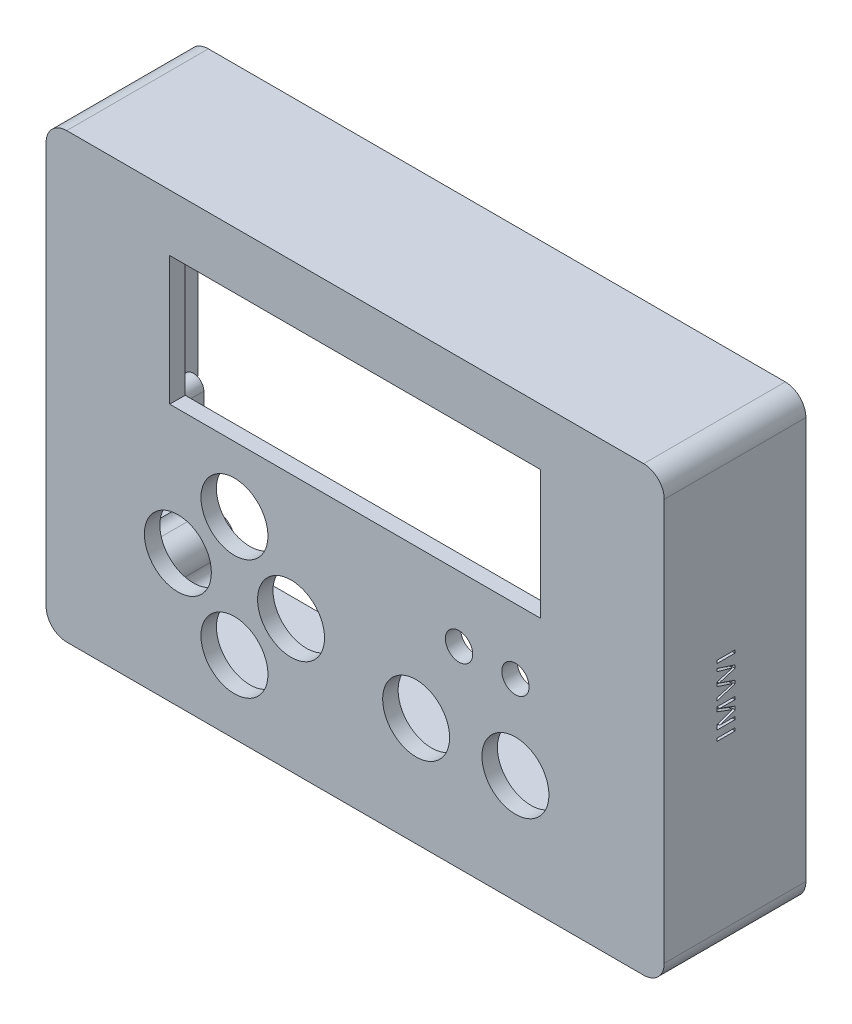
from build123d import *
from build123d.topology import SkipClean

# Parameters (mm, degrees)
SKETCH2_R           = 6.5
SKETCH2_R_2         = 2.65
SKETCH2_W           = 72
SKETCH2_H           = 25
BOSS_EXTRUDE1_DEPTH = 2.5
BOSS_EXTRUDE2_START = 25
BOSS_EXTRUDE2_DEPTH = 25
BOSS_EXTRUDE3_START = 0.5
SKETCH5_R           = 3.75
SKETCH5_R_2         = 2.65
SKETCH5_R_3         = 7.5
SKETCH5_R_4         = 6.5
SKETCH5_W           = 74
SKETCH5_H           = 27
SKETCH5_W_2         = 72
SKETCH5_H_2         = 25
BOSS_EXTRUDE3_DEPTH = 0.5
BOSS_EXTRUDE4_DEPTH = 4
BOSS_EXTRUDE6_START = 25
SKETCH7_R           = 1.7
BOSS_EXTRUDE6_DEPTH = 25
FILLET2_R           = 2
CUT_EXTRUDE1_REACH  = 131.9
SKETCH8_W           = 10
SKETCH8_H           = 20
SKETCH9_W           = 3.5
SKETCH9_H           = 0.538461538
CUT_EXTRUDE2_DEPTH  = 0.75


with BuildPart() as part:
    # Sketch2 → Boss-Extrude1 (new body)
    with BuildSketch(Plane.XY):
        with BuildLine():
            Line((-56, -43), (56, -43))
            ThreePointArc((56, -43), (58.828427125, -41.828427125), (60, -39))
            Line((60, -39), (60, 39))
            ThreePointArc((60, 39), (58.828427125, 41.828427125), (56, 43))
            Line((56, 43), (-56, 43))
            ThreePointArc((-56, 43), (-58.828427125, 41.828427125), (-60, 39))
            Line((-60, 39), (-60, -39))
            ThreePointArc((-60, -39), (-58.828427125, -41.828427125), (-56, -43))
        make_face()
        with Locations((-23.434370971, -5.641343994)):
            Circle(SKETCH2_R, mode=Mode.SUBTRACT)
        with Locations((-12.448394444, -17.273554435)):
            Circle(SKETCH2_R, mode=Mode.SUBTRACT)
        with Locations((-34.420347499, -17.273554435)):
            Circle(SKETCH2_R, mode=Mode.SUBTRACT)
        with Locations((-23.434370971, -28.905764876)):
            Circle(SKETCH2_R, mode=Mode.SUBTRACT)
        with Locations((11.834339557, -21.891431756)):
            Circle(SKETCH2_R, mode=Mode.SUBTRACT)
        with Locations((31.111647175, -21.891431756)):
            Circle(SKETCH2_R, mode=Mode.SUBTRACT)
        with Locations((20.158631483, -5.641343994)):
            Circle(SKETCH2_R_2, mode=Mode.SUBTRACT)
        with Locations((31.111647175, -5.641343994)):
            Circle(SKETCH2_R_2, mode=Mode.SUBTRACT)
        with Locations((0, 19.5)):
            Rectangle(SKETCH2_W, SKETCH2_H, mode=Mode.SUBTRACT)
    extrude(amount=BOSS_EXTRUDE1_DEPTH)

    # Sketch3 → Boss-Extrude2 (add)
    with BuildSketch(Plane(origin=(0, 0, 0), x_dir=(-1, 0, 0), z_dir=(0, 0, -1)).offset(BOSS_EXTRUDE2_START)):
        with BuildLine():
            Line((60, 39), (60, -39))
            ThreePointArc((60, -39), (58.828427125, -41.828427125), (56, -43))
            Line((56, -43), (-56, -43))
            ThreePointArc((-56, -43), (-58.828427125, -41.828427125), (-60, -39))
            Line((-60, -39), (-60, 39))
            ThreePointArc((-60, 39), (-58.828427125, 41.828427125), (-56, 43))
            Line((-56, 43), (56, 43))
            ThreePointArc((56, 43), (58.828427125, 41.828427125), (60, 39))
        make_face()
        with BuildLine():
            Line((-54, 41), (54, 41))
            ThreePointArc((54, 41), (56.828427125, 39.828427125), (58, 37))
            Line((58, 37), (58, -37))
            ThreePointArc((58, -37), (56.828427125, -39.828427125), (54, -41))
            Line((54, -41), (-54, -41))
            ThreePointArc((-54, -41), (-56.828427125, -39.828427125), (-58, -37))
            Line((-58, -37), (-58, 37))
            ThreePointArc((-58, 37), (-56.828427125, 39.828427125), (-54, 41))
        make_face(mode=Mode.SUBTRACT)
    extrude(amount=-BOSS_EXTRUDE2_DEPTH)

    # Sketch5 → Boss-Extrude3 (add)
    # profile 1 of 9: a face of its own
    with SkipClean():  # the faces are left unmerged after this step: merging them gives an invalid solid
        with BuildSketch(Plane(origin=(0, 0, 0), x_dir=(-1, 0, 0), z_dir=(0, 0, -1)).offset(BOSS_EXTRUDE3_START)):
            with Locations((-31.111647175, -5.641343994)):
                Circle(SKETCH5_R)
            with Locations((-31.111647175, -5.641343994)):
                Circle(SKETCH5_R_2, mode=Mode.SUBTRACT)
        # profile 2 of 9: a face of its own
        with BuildSketch(Plane(origin=(0, 0, 0), x_dir=(-1, 0, 0), z_dir=(0, 0, -1)).offset(BOSS_EXTRUDE3_START)):
            with Locations((-20.158631483, -5.641343994)):
                Circle(SKETCH5_R)
            with Locations((-20.158631483, -5.641343994)):
                Circle(SKETCH5_R_2, mode=Mode.SUBTRACT)
        # profile 3 of 9: a face of its own
        with BuildSketch(Plane(origin=(0, 0, 0), x_dir=(-1, 0, 0), z_dir=(0, 0, -1)).offset(BOSS_EXTRUDE3_START)):
            with Locations((-31.111647175, -21.891431756)):
                Circle(SKETCH5_R_3)
            with Locations((-31.111647175, -21.891431756)):
                Circle(SKETCH5_R_4, mode=Mode.SUBTRACT)
        # profile 4 of 9: a face of its own
        with BuildSketch(Plane(origin=(0, 0, 0), x_dir=(-1, 0, 0), z_dir=(0, 0, -1)).offset(BOSS_EXTRUDE3_START)):
            with Locations((-11.834339557, -21.891431756)):
                Circle(SKETCH5_R_3)
            with Locations((-11.834339557, -21.891431756)):
                Circle(SKETCH5_R_4, mode=Mode.SUBTRACT)
        # profile 5 of 9: a face of its own
        with BuildSketch(Plane(origin=(0, 0, 0), x_dir=(-1, 0, 0), z_dir=(0, 0, -1)).offset(BOSS_EXTRUDE3_START)):
            with Locations((12.448394444, -17.273554435)):
                Circle(SKETCH5_R_3)
            with Locations((12.448394444, -17.273554435)):
                Circle(SKETCH5_R_4, mode=Mode.SUBTRACT)
        # profile 6 of 9: a face of its own
        with BuildSketch(Plane(origin=(0, 0, 0), x_dir=(-1, 0, 0), z_dir=(0, 0, -1)).offset(BOSS_EXTRUDE3_START)):
            with Locations((23.434370971, -5.641343994)):
                Circle(SKETCH5_R_3)
            with Locations((23.434370971, -5.641343994)):
                Circle(SKETCH5_R_4, mode=Mode.SUBTRACT)
        # profile 7 of 9: a face of its own
        with BuildSketch(Plane(origin=(0, 0, 0), x_dir=(-1, 0, 0), z_dir=(0, 0, -1)).offset(BOSS_EXTRUDE3_START)):
            with Locations((34.420347499, -17.273554435)):
                Circle(SKETCH5_R_3)
            with Locations((34.420347499, -17.273554435)):
                Circle(SKETCH5_R_4, mode=Mode.SUBTRACT)
        # profile 8 of 9: a face of its own
        with BuildSketch(Plane(origin=(0, 0, 0), x_dir=(-1, 0, 0), z_dir=(0, 0, -1)).offset(BOSS_EXTRUDE3_START)):
            with Locations((23.434370971, -28.905764876)):
                Circle(SKETCH5_R_3)
            with Locations((23.434370971, -28.905764876)):
                Circle(SKETCH5_R_4, mode=Mode.SUBTRACT)
        # profile 9 of 9: a face of its own
        with BuildSketch(Plane(origin=(0, 0, 0), x_dir=(-1, 0, 0), z_dir=(0, 0, -1)).offset(BOSS_EXTRUDE3_START)):
            with Locations((0, 19.5)):
                Rectangle(SKETCH5_W, SKETCH5_H)
            with Locations((0, 19.5)):
                Rectangle(SKETCH5_W_2, SKETCH5_H_2, mode=Mode.SUBTRACT)
        extrude(amount=-BOSS_EXTRUDE3_DEPTH)

    # Sketch6 → Boss-Extrude4 (add)
    # profile 1 of 4: a face of its own
    with SkipClean():  # the faces are left unmerged after this step: merging them gives an invalid solid
        with BuildSketch(Plane(origin=(0, 0, 0), x_dir=(-1, 0, 0), z_dir=(0, 0, -1))):
            with BuildLine():
                Line((39.875, 38), (39.875, 34))
                ThreePointArc((39.875, 34), (37.875, 32), (35.875, 34))
                Line((35.875, 34), (35.875, 38))
                ThreePointArc((35.875, 38), (37.875, 40), (39.875, 38))
            make_face()
            with BuildLine():
                Line((37.125, 35), (37.125, 37))
                ThreePointArc((37.125, 37), (37.875, 37.75), (38.625, 37))
                Line((38.625, 37), (38.625, 35))
                ThreePointArc((38.625, 35), (37.875, 34.25), (37.125, 35))
            make_face(mode=Mode.SUBTRACT)
        # profile 2 of 4: a face of its own
        with BuildSketch(Plane(origin=(0, 0, 0), x_dir=(-1, 0, 0), z_dir=(0, 0, -1))):
            with BuildLine():
                Line((39.875, 2), (39.875, 6))
                ThreePointArc((39.875, 6), (37.875, 8), (35.875, 6))
                Line((35.875, 6), (35.875, 2))
                ThreePointArc((35.875, 2), (37.875, 0), (39.875, 2))
            make_face()
            with BuildLine():
                Line((37.125, 5), (37.125, 3))
                ThreePointArc((37.125, 3), (37.875, 2.25), (38.625, 3))
                Line((38.625, 3), (38.625, 5))
                ThreePointArc((38.625, 5), (37.875, 5.75), (37.125, 5))
            make_face(mode=Mode.SUBTRACT)
        # profile 3 of 4: a face of its own
        with BuildSketch(Plane(origin=(0, 0, 0), x_dir=(-1, 0, 0), z_dir=(0, 0, -1))):
            with BuildLine():
                Line((-39.875, 2), (-39.875, 6))
                ThreePointArc((-39.875, 6), (-37.875, 8), (-35.875, 6))
                Line((-35.875, 6), (-35.875, 2))
                ThreePointArc((-35.875, 2), (-37.875, 0), (-39.875, 2))
            make_face()
            with BuildLine():
                Line((-37.125, 5), (-37.125, 3))
                ThreePointArc((-37.125, 3), (-37.875, 2.25), (-38.625, 3))
                Line((-38.625, 3), (-38.625, 5))
                ThreePointArc((-38.625, 5), (-37.875, 5.75), (-37.125, 5))
            make_face(mode=Mode.SUBTRACT)
        # profile 4 of 4: a face of its own
        with BuildSketch(Plane(origin=(0, 0, 0), x_dir=(-1, 0, 0), z_dir=(0, 0, -1))):
            with BuildLine():
                Line((-39.875, 38), (-39.875, 34))
                ThreePointArc((-39.875, 34), (-37.875, 32), (-35.875, 34))
                Line((-35.875, 34), (-35.875, 38))
                ThreePointArc((-35.875, 38), (-37.875, 40), (-39.875, 38))
            make_face()
            with BuildLine():
                Line((-37.125, 35), (-37.125, 37))
                ThreePointArc((-37.125, 37), (-37.875, 37.75), (-38.625, 37))
                Line((-38.625, 37), (-38.625, 35))
                ThreePointArc((-38.625, 35), (-37.875, 34.25), (-37.125, 35))
            make_face(mode=Mode.SUBTRACT)
        extrude(amount=BOSS_EXTRUDE4_DEPTH)

    # Sketch7 → Boss-Extrude6 (add)
    # profile 1 of 4: a face of its own
    with SkipClean():  # the faces are left unmerged after this step: merging them gives an invalid solid
        with BuildSketch(Plane(origin=(0, 0, 0), x_dir=(-1, 0, 0), z_dir=(0, 0, -1)).offset(BOSS_EXTRUDE6_START)):
            with BuildLine():
                ThreePointArc((54, -41), (56.828427125, -39.828427125), (58, -37))
                Line((58, -37), (58, -36.3))
                ThreePointArc((58, -36.3), (51.88370491, -34.88370491), (53.3, -41))
                Line((53.3, -41), (54, -41))
            make_face()
            with Locations((54.5, -37.5)):
                Circle(SKETCH7_R, mode=Mode.SUBTRACT)
        # profile 2 of 4: a face of its own
        with BuildSketch(Plane(origin=(0, 0, 0), x_dir=(-1, 0, 0), z_dir=(0, 0, -1)).offset(BOSS_EXTRUDE6_START)):
            with BuildLine():
                ThreePointArc((53.3, 41), (51.88370491, 34.88370491), (58, 36.3))
                Line((58, 36.3), (58, 37))
                ThreePointArc((58, 37), (56.828427125, 39.828427125), (54, 41))
                Line((54, 41), (53.3, 41))
            make_face()
            with Locations((54.5, 37.5)):
                Circle(SKETCH7_R, mode=Mode.SUBTRACT)
        # profile 3 of 4: a face of its own
        with BuildSketch(Plane(origin=(0, 0, 0), x_dir=(-1, 0, 0), z_dir=(0, 0, -1)).offset(BOSS_EXTRUDE6_START)):
            with BuildLine():
                ThreePointArc((-58, 36.3), (-51.88370491, 34.88370491), (-53.3, 41))
                Line((-53.3, 41), (-54, 41))
                ThreePointArc((-54, 41), (-56.828427125, 39.828427125), (-58, 37))
                Line((-58, 37), (-58, 36.3))
            make_face()
            with Locations((-54.5, 37.5)):
                Circle(SKETCH7_R, mode=Mode.SUBTRACT)
        # profile 4 of 4: a face of its own
        with BuildSketch(Plane(origin=(0, 0, 0), x_dir=(-1, 0, 0), z_dir=(0, 0, -1)).offset(BOSS_EXTRUDE6_START)):
            with BuildLine():
                Line((-54, -41), (-53.3, -41))
                ThreePointArc((-53.3, -41), (-51.88370491, -34.88370491), (-58, -36.3))
                Line((-58, -36.3), (-58, -37))
                ThreePointArc((-58, -37), (-56.828427125, -39.828427125), (-54, -41))
            make_face()
            with Locations((-54.5, -37.5)):
                Circle(SKETCH7_R, mode=Mode.SUBTRACT)
        extrude(amount=-BOSS_EXTRUDE6_DEPTH)

    # Fillet2
    fillet2_edges = [part.edges().sort_by_distance(p)[0] for p in [
        (-58, -36.3, -12.5),
        (-53.3, -41, -12.5),
        (-53.3, 41, -12.5),
        (-58, 36.3, -12.5),
        (58, 36.3, -12.5),
        (53.3, 41, -12.5),
        (53.3, -41, -12.5),
        (58, -36.3, -12.5),
    ]]
    fillet(fillet2_edges, radius=FILLET2_R)

    # Sketch8 → Cut-Extrude1 (cut, up to next)
    with BuildSketch(Plane.ZY.offset(60), mode=Mode.PRIVATE) as cut_extrude1_sk1:
        with Locations((-20, -23)):
            Rectangle(SKETCH8_W, SKETCH8_H)
    cut_extrude1_tool1 = extrude(cut_extrude1_sk1.sketch, amount=-CUT_EXTRUDE1_REACH, mode=Mode.PRIVATE) & part.part
    add(cut_extrude1_tool1.solids().sort_by_distance((-60, -23, -20))[0], mode=Mode.SUBTRACT)

    # Sketch9 → Cut-Extrude2 (cut)
    with SkipClean():  # the faces are left unmerged after this step: merging them gives an invalid solid
        with BuildSketch(Plane(origin=(60, 0, 0), x_dir=(0, 0, -1), z_dir=(1, 0, 0))):
            with Locations((9.5, -6.546794872)):
                Rectangle(SKETCH9_W, SKETCH9_H)
            with BuildLine():
                Line((11.25, -4.904487179), (7.75, -4.904487179))
                Line((7.75, -4.904487179), (7.75, -4.052624199))
                Line((7.75, -4.052624199), (10.206029647, -3.136959135))
                add(Edge.make_bspline(
                    [(10.206029647, -3.136959135), (10.233870221, -3.126990317), (10.287746992, -3.10769877), (10.365226682, -3.078474407), (10.437806674, -3.053067071), (10.504262361, -3.027933316), (10.565911204, -3.006470343), (10.622171596, -2.987089355), (10.672529576, -2.968313622), (10.704730686, -2.957619254), (10.719951923, -2.952564103)],
                    knots=[0, 0, 0, 0, 1.299784919, 2.515329424, 3.639592589, 4.679603176, 5.63803277, 6.508713614, 7.295079448, 8, 8, 8, 8], degree=3))
                add(Edge.make_bspline(
                    [(10.719951923, -2.952564103), (10.703382573, -2.946652123), (10.668227412, -2.934108687), (10.612233363, -2.915788451), (10.551082572, -2.893797378), (10.484763502, -2.868940226), (10.412219379, -2.843432141), (10.334591538, -2.814380139), (10.251122481, -2.783628298), (10.193639868, -2.762335397), (10.16396234, -2.751342147)],
                    knots=[0, 0, 0, 0, 0.714017512, 1.514929669, 2.391012348, 3.351368917, 4.389525191, 5.5119716, 6.715463164, 8, 8, 8, 8], degree=3))
                Line((10.16396234, -2.751342147), (7.75, -1.847596154))
                Line((7.75, -1.847596154), (7.75, -1.000641026))
                Line((7.75, -1.000641026), (11.25, -1.000641026))
                Line((11.25, -1.000641026), (11.25, -1.539102564))
                Line((11.25, -1.539102564), (8.288461538, -1.539102564))
                Line((8.288461538, -1.539102564), (11.25, -2.629346955))
                Line((11.25, -2.629346955), (11.25, -3.280689103))
                Line((11.25, -3.280689103), (8.288461538, -4.366025641))
                Line((8.288461538, -4.366025641), (11.25, -4.366025641))
                Line((11.25, -4.366025641), (11.25, -4.904487179))
            make_face()
            with BuildLine():
                Line((11.25, 1.103705929), (7.75, -0.031410256))
                Line((7.75, -0.031410256), (7.75, 0.525981571))
                Line((7.75, 0.525981571), (10.044771635, 1.178725962))
                add(Edge.make_bspline(
                    [(10.044771635, 1.178725962), (10.163957986, 1.212628844), (10.402546925, 1.280496117), (10.641188205, 1.348179113), (10.760616987, 1.382051282)],
                    knots=[0, 0, 0, 0, 0.999093686, 2, 2, 2, 2], degree=3))
                add(Edge.make_bspline(
                    [(10.760616987, 1.382051282), (10.719229194, 1.396010439), (10.641074402, 1.422370265), (10.530962087, 1.460575357), (10.434357162, 1.493282315), (10.351503254, 1.521660694), (10.282086901, 1.544322771), (10.226706894, 1.563736111), (10.184649668, 1.577334437), (10.161379734, 1.58557564), (10.152043269, 1.588882212)],
                    knots=[0, 0, 0, 0, 1.630889539, 3.079696317, 4.351855895, 5.439115587, 6.349752836, 7.07828354, 7.630184903, 8, 8, 8, 8], degree=3))
                Line((10.152043269, 1.588882212), (7.75, 2.407091346))
                Line((7.75, 2.407091346), (7.75, 3.147475962))
                Line((7.75, 3.147475962), (9.490885417, 3.704166667))
                add(Edge.make_bspline(
                    [(9.490885417, 3.704166667), (9.599892428, 3.735736388), (9.815244925, 3.798105021), (10.136540085, 3.882041743), (10.45033528, 3.960884563), (10.658140414, 4.00682983), (10.760616987, 4.029487179)],
                    knots=[0, 0, 0, 0, 1.038719052, 2.052076637, 3.039405299, 4, 4, 4, 4], degree=3))
                add(Edge.make_bspline(
                    [(10.760616987, 4.029487179), (10.711064647, 4.043487061), (10.605627045, 4.073276047), (10.438387015, 4.121051195), (10.252257975, 4.173523413), (10.122119881, 4.210579082), (10.053886218, 4.230008013)],
                    knots=[0, 0, 0, 0, 0.841112725, 1.789721902, 2.841112808, 4, 4, 4, 4], degree=3))
                Line((10.053886218, 4.230008013), (7.75, 4.884855769))
                Line((7.75, 4.884855769), (7.75, 5.442948718))
                Line((7.75, 5.442948718), (11.25, 4.308533654))
                Line((11.25, 4.308533654), (11.25, 3.721694712))
                Line((11.25, 3.721694712), (8.559795673, 2.892267628))
                add(Edge.make_bspline(
                    [(8.559795673, 2.892267628), (8.533383574, 2.884098181), (8.483596182, 2.868698591), (8.413304815, 2.846786951), (8.351773344, 2.828072586), (8.299061082, 2.811602154), (8.254865033, 2.798887895), (8.219951852, 2.786910108), (8.193219898, 2.779789941), (8.178605573, 2.774991035), (8.172776442, 2.773076923)],
                    knots=[0, 0, 0, 0, 1.638461664, 3.088536575, 4.363459565, 5.449995503, 6.361396077, 7.088514178, 7.63644095, 8, 8, 8, 8], degree=3))
                add(Edge.make_bspline(
                    [(8.172776442, 2.773076923), (8.221152015, 2.75647861), (8.312030302, 2.72529704), (8.439775458, 2.681551146), (8.550323292, 2.644862112), (8.618003936, 2.621679439), (8.648838141, 2.611117788)],
                    knots=[0, 0, 0, 0, 1.220477349, 2.292787169, 3.222221483, 4, 4, 4, 4], degree=3))
                Line((8.648838141, 2.611117788), (11.25, 1.72489984))
                Line((11.25, 1.72489984), (11.25, 1.103705929))
            make_face()
            with Locations((9.5, 6.546794872)):
                Rectangle(SKETCH9_W, SKETCH9_H)
        extrude(amount=-CUT_EXTRUDE2_DEPTH, mode=Mode.SUBTRACT)


solid = part.part
